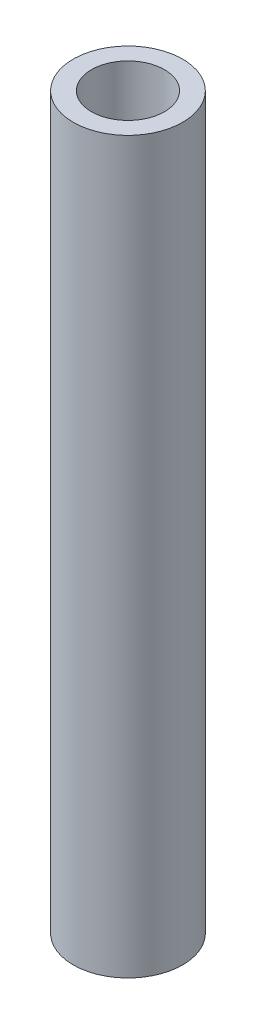
from build123d import *

# Parameters (mm, degrees)
SKETCH1_R           = 9.525
SKETCH1_R_2         = 6.35
BOSS_EXTRUDE2_DEPTH = 127


with BuildPart() as part:
    # Sketch1 → Boss-Extrude2 (new body)
    with BuildSketch(Plane(origin=(0, 0, 0), x_dir=(1, 0, 0), z_dir=(0, 1, 0))):
        with Locations(Location((0, 0, 0), (0, 0, 270))):
            Circle(SKETCH1_R)
        with Locations(Location((0, 0, 0), (0, 0, 270))):
            Circle(SKETCH1_R_2, mode=Mode.SUBTRACT)
    extrude(amount=BOSS_EXTRUDE2_DEPTH)


solid = part.part
